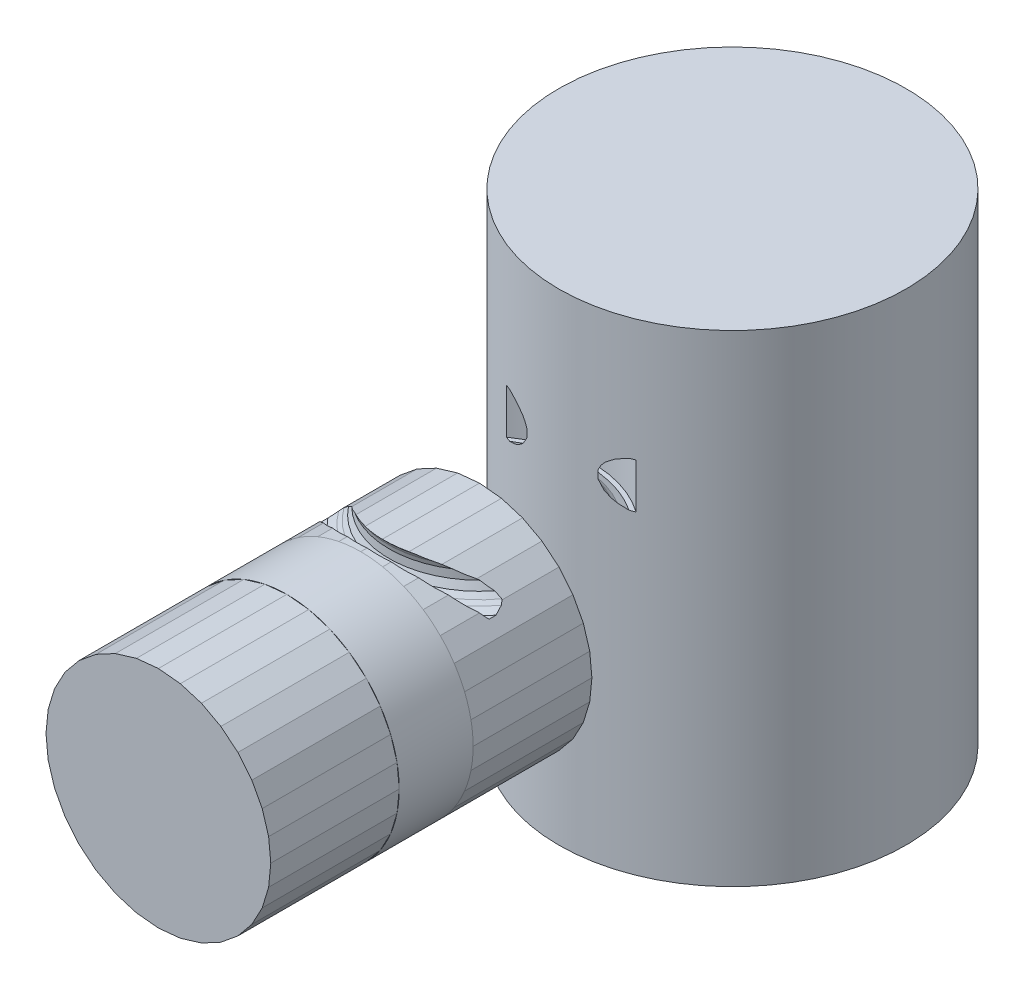
from build123d import *

# Parameters (mm, degrees)
CADVIEW_CORE_EXTRUDE_DEPTH        = 20
CADVIEW_START                     = -15
CADVIEW_RESIDUAL_BOSS_PROFILE_1_R = 10.815419751
CADVIEW_RESIDUAL_BOSS_1_DEPTH     = 30
CADVIEW_START_2                   = -10
CADVIEW_RESIDUAL_CUT_PROFILE_2_W  = 30
CADVIEW_RESIDUAL_CUT_PROFILE_2_H  = 4.600000381
CADVIEW_RESIDUAL_CUT_2_DEPTH      = 20
CADVIEW_START_3                   = 7.396679878
CADVIEW_RESIDUAL_BOSS_PROFILE_3_R = 7.000000085
CADVIEW_RESIDUAL_BOSS_3_DEPTH     = 4.603320122


with BuildPart() as part:
    # CADView Core Profile → CADView Core Extrude (new body)
    with BuildSketch(Plane.XY):
        Polygon((-7, 0), (-6.865497112, -1.365632296), (-6.467156887, -2.678784132), (-5.820287228, -3.888991594), (-4.949747562, -4.949747562), (-3.888991594, -5.820287228), (-2.678784132, -6.467156887), (-1.365632296, -6.865497112), (0, -7), (1.365632296, -6.865497112), (2.678784132, -6.467156887), (3.888991594, -5.820287228), (4.949747562, -4.949747562), (5.820287228, -3.888991594), (6.467156887, -2.678784132), (6.865497112, -1.365632296), (7, 0), (6.865497112, 1.365632296), (6.467156887, 2.678784132), (5.820287228, 3.888991594), (4.949747562, 4.949747562), (3.888991594, 5.820287228), (2.678784132, 6.467156887), (1.365632296, 6.865497112), (0, 7), (-1.365632296, 6.865497112), (-2.678784132, 6.467156887), (-3.888991594, 5.820287228), (-4.949747562, 4.949747562), (-5.820287228, 3.888991594), (-6.467156887, 2.678784132), (-6.865497112, 1.365632296), align=None)
    extrude(amount=CADVIEW_CORE_EXTRUDE_DEPTH)

    # CADView Residual Boss Profile 3 → CADView Residual Boss 3 (add)
    with BuildSketch(Plane.XY.offset(CADVIEW_START_3)):
        with Locations(Location((0, 0, 0), (0, 0, 180))):
            Circle(CADVIEW_RESIDUAL_BOSS_PROFILE_3_R)
    extrude(amount=CADVIEW_RESIDUAL_BOSS_3_DEPTH)


with BuildPart() as body_2:
    # CADView Residual Boss Profile 1 → CADView Residual Boss 1 (new body)
    with BuildSketch(Plane(origin=(0, 0, 0), x_dir=(1, 0, 0), z_dir=(0, 1, 0)).offset(CADVIEW_START)):
        with Locations(Location((0, 15.754607839, 0), (0, 0, 270))):
            Circle(CADVIEW_RESIDUAL_BOSS_PROFILE_1_R)
    extrude(amount=CADVIEW_RESIDUAL_BOSS_1_DEPTH)

    # CADView Residual Cut Profile 2 → CADView Residual Cut 2 (cut)
    with BuildSketch(Plane(origin=(0, 0, 0), x_dir=(0, 0, -1), z_dir=(1, 0, 0)).offset(CADVIEW_START_2)):
        with Locations((0, 9.699999809)):
            Rectangle(CADVIEW_RESIDUAL_CUT_PROFILE_2_W, CADVIEW_RESIDUAL_CUT_PROFILE_2_H)
    extrude(amount=-CADVIEW_RESIDUAL_CUT_2_DEPTH, mode=Mode.SUBTRACT)


with BuildPart() as cadview_residual_revolve_cut_4_tool:
    # CADView Residual Revolve Cut Profile 4 → CADView Residual Revolve Cut 4 (revolve)
    with BuildSketch(Plane(origin=(0, 0, 0), x_dir=(0, 0, -1), z_dir=(1, 0, 0))):
        Polygon((7.000000188, 4.600000381), (7.000000188, 7.399999619), (6.719402111, 7.399999619), (6.189840539, 7.13749969), (5.843903878, 6.787499785), (5.716408503, 6.554166516), (5.625853783, 6.262499928), (5.625853783, 5.737500072), (5.809947921, 5.270833532), (6.047682267, 4.979166945), (6.281648991, 4.804166993), (6.719402111, 4.600000381), align=None)
    revolve(axis=Axis((0, 4.46000042, 0), (0, 1, 0)))


with BuildPart() as part_1:
    add(part.part)

    # CADView Residual Revolve Cut 4: cut by cadview_residual_revolve_cut_4_tool
    add(cadview_residual_revolve_cut_4_tool.part, mode=Mode.SUBTRACT)


with BuildPart() as body_2_1:
    add(body_2.part)

    # CADView Residual Revolve Cut 4: cut by cadview_residual_revolve_cut_4_tool
    add(cadview_residual_revolve_cut_4_tool.part, mode=Mode.SUBTRACT)


solid = Compound([part_1.part, body_2_1.part])
